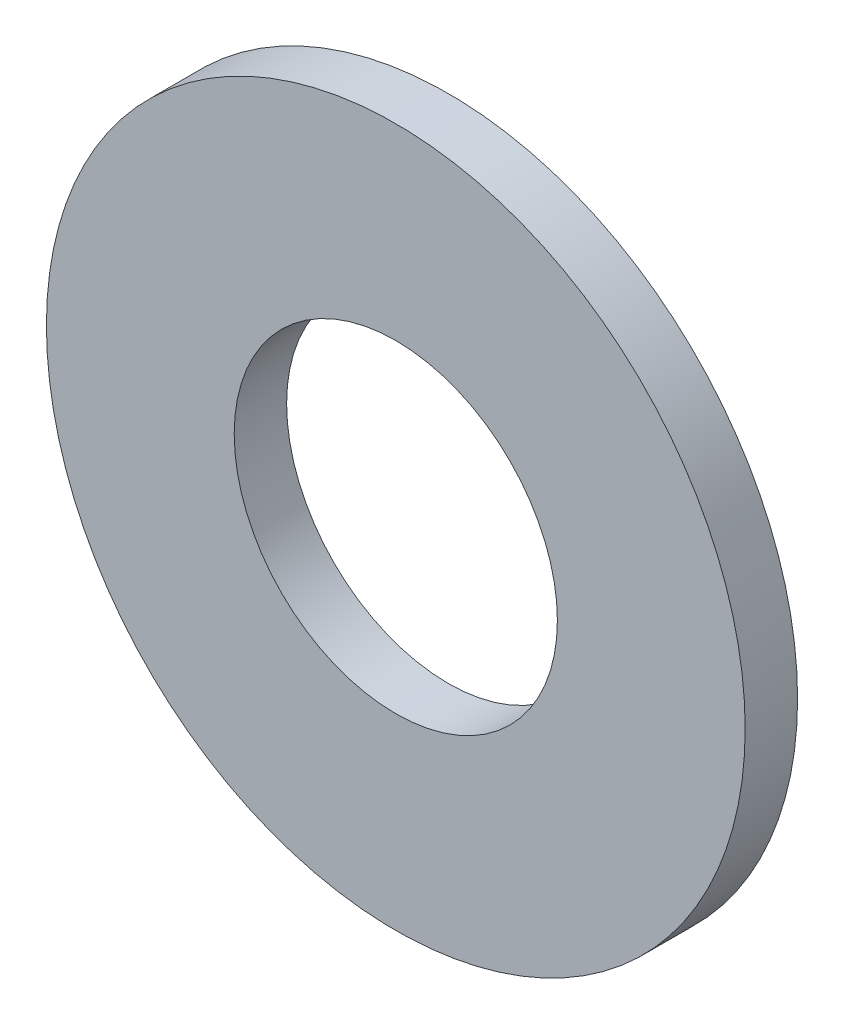
from build123d import *

# Parameters (mm, degrees)
SKETCH1_R           = 20
SKETCH1_R_2         = 9.25
BOSS_EXTRUDE1_DEPTH = 3


with BuildPart() as part:
    # Sketch1 → Boss-Extrude1 (new body)
    with BuildSketch(Plane.XY):
        Circle(SKETCH1_R)
        Circle(SKETCH1_R_2, mode=Mode.SUBTRACT)
    extrude(amount=BOSS_EXTRUDE1_DEPTH)


solid = part.part
